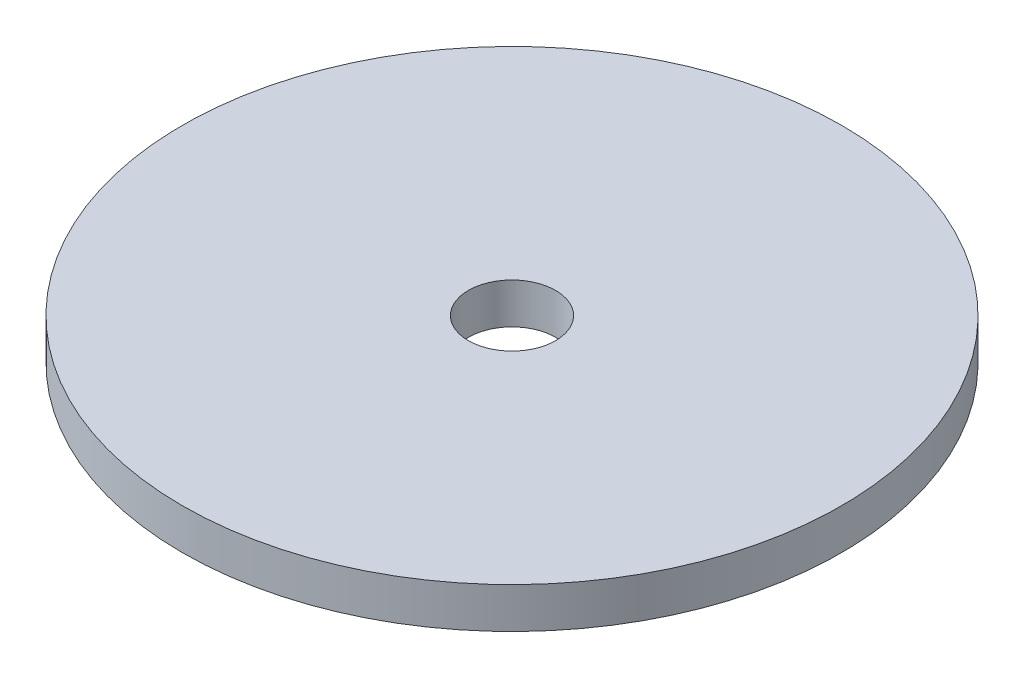
from build123d import *

# Parameters (mm, degrees)
SKETCH1_R              = 19.304
BOSS_EXTRUDE1_DEPTH    = 1.190625
F_10_CLEARANCE_HOLE1_D = 5.1054


with BuildPart() as part:
    # Sketch1 → Boss-Extrude1 (new, symmetric)
    with BuildSketch(Plane(origin=(0, 0, 0), x_dir=(1, 0, 0), z_dir=(0, 1, 0))):
        with Locations(Location((0, 0, 0), (0, 0, 90))):
            Circle(SKETCH1_R)
    extrude(amount=BOSS_EXTRUDE1_DEPTH, both=True)

    # #10 Clearance Hole1 (through all)
    with Locations(Plane(origin=(0, 1.190625, 0), x_dir=(1, 0, 0), z_dir=(0, 1, 0))):
        with Locations((0, 0)):
            Hole(F_10_CLEARANCE_HOLE1_D / 2)


solid = part.part
